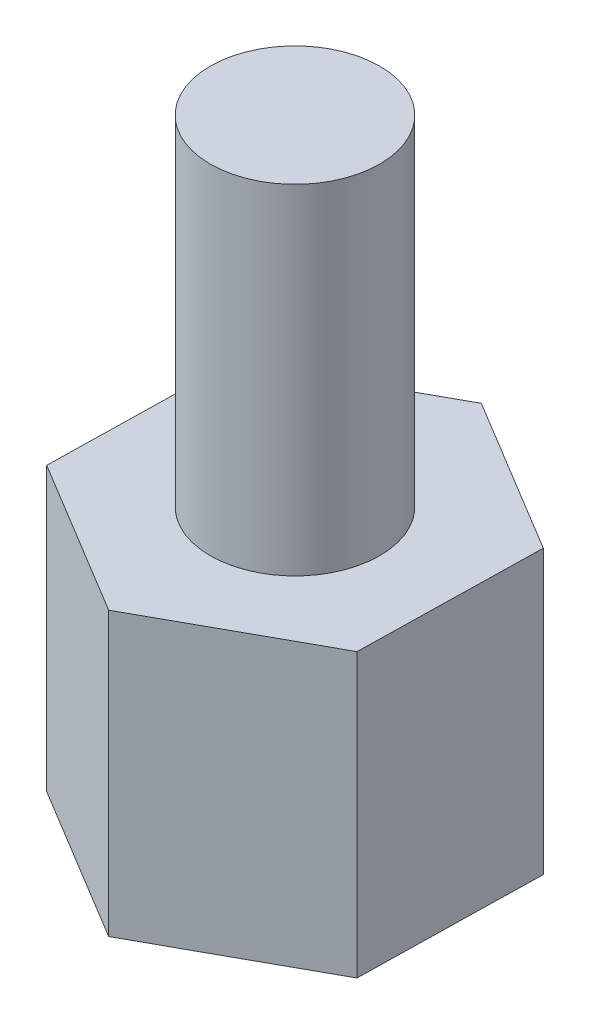
from build123d import *

# Parameters (mm, degrees)
SKETCH1_R           = 1.5
BOSS_EXTRUDE1_DEPTH = 5
SKETCH2_R           = 1.5
BOSS_EXTRUDE2_DEPTH = 6


with BuildPart() as part:
    # Sketch1 → Boss-Extrude1 (new body)
    with BuildSketch(Plane(origin=(0, 0, 0), x_dir=(1, 0, 0), z_dir=(0, 1, 0))):
        Polygon((2.767794612, -1.671121275), (2.831130783, 1.561419809), (0.063336171, 3.232541084), (-2.767794612, 1.671121275), (-2.831130783, -1.561419809), (-0.063336171, -3.232541084), align=None)
        with Locations(Location((0, 0, 0), (0, 0, 270))):
            Circle(SKETCH1_R, mode=Mode.SUBTRACT)
    extrude(amount=BOSS_EXTRUDE1_DEPTH)


with BuildPart() as body_2:
    # Sketch2 → Boss-Extrude2 (new body)
    with BuildSketch(Plane(origin=(0, 5, 0), x_dir=(1, 0, 0), z_dir=(0, 1, 0))):
        with Locations(Location((0, 0, 0), (0, 0, 270))):
            Circle(SKETCH2_R)
    extrude(amount=BOSS_EXTRUDE2_DEPTH)


solid = Compound([part.part, body_2.part])
